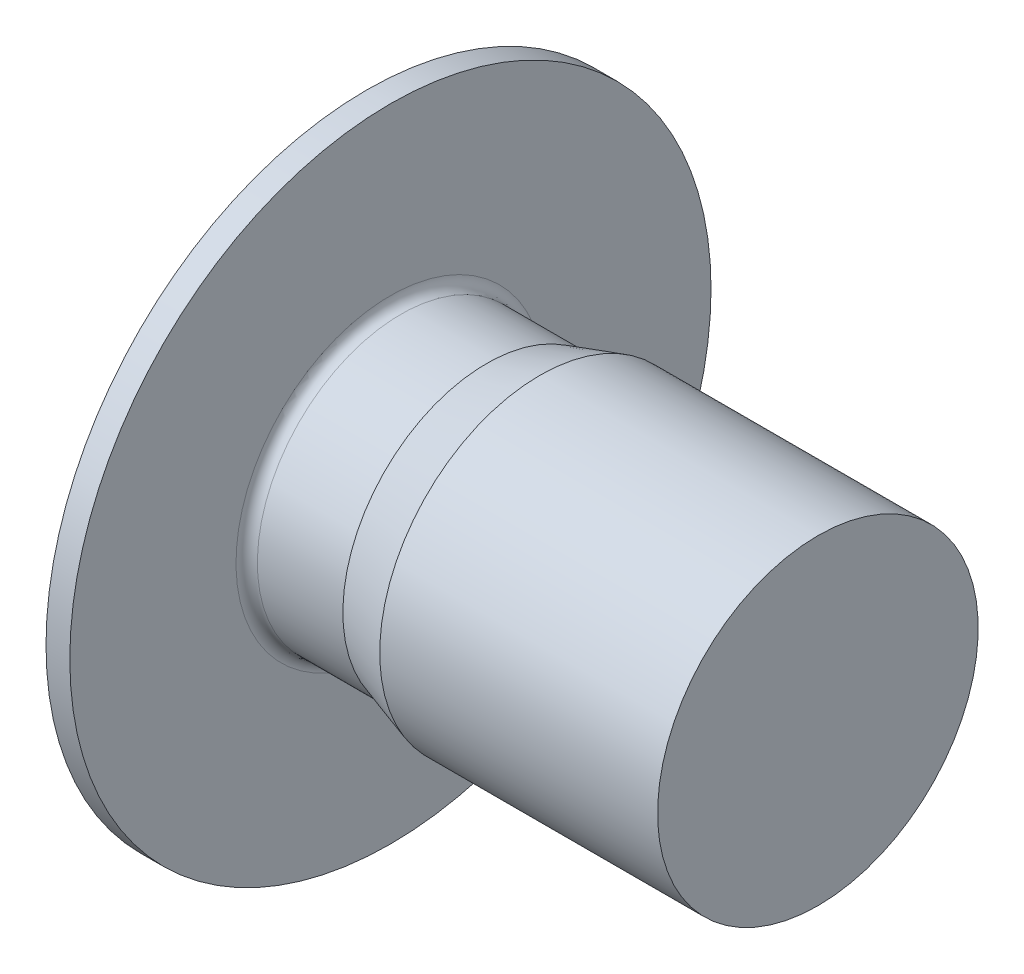
from build123d import *

# Parameters (mm, degrees)
FILLET1_R          = 0.1
CUT_EXTRUDE1_DEPTH = 2


with BuildPart() as part:
    # Sketch1 → Revolve1 (revolve)
    with BuildSketch(Plane.XY):
        Polygon((-0.8, 0), (-0.8, 2), (-0.222649731, 3), (0, 3), (0, 1.345), (0.9, 1.345), (1.4, 1.5), (4, 1.5), (4, 0), align=None)
    revolve(axis=Axis((-0.8, 0, 0), (1, 0, 0)))

    # Fillet1
    fillet1_edges = [part.edges().sort_by_distance(p)[0] for p in [
        (0, -1.345, 0),
    ]]
    fillet(fillet1_edges, radius=FILLET1_R)

    # Sketch2 → Cut-Extrude1 (cut)
    with BuildSketch(Plane.ZY.offset(0.8)):
        Polygon((0, 0.866025404), (-0.75, 0.433012702), (-0.75, -0.433012702), (0, -0.866025404), (0.75, -0.433012702), (0.75, 0.433012702), align=None)
    extrude(amount=-CUT_EXTRUDE1_DEPTH, mode=Mode.SUBTRACT)

    # Sketch3 → Cut-Revolve1 (revolve, cut)
    with BuildSketch(Plane.XY):
        Polygon((1.2, 0), (1.2, 0.75), (1.650645464, 0), align=None)
    revolve(axis=Axis((1.2, 0, 0), (1, 0, 0)), mode=Mode.SUBTRACT)


solid = part.part
